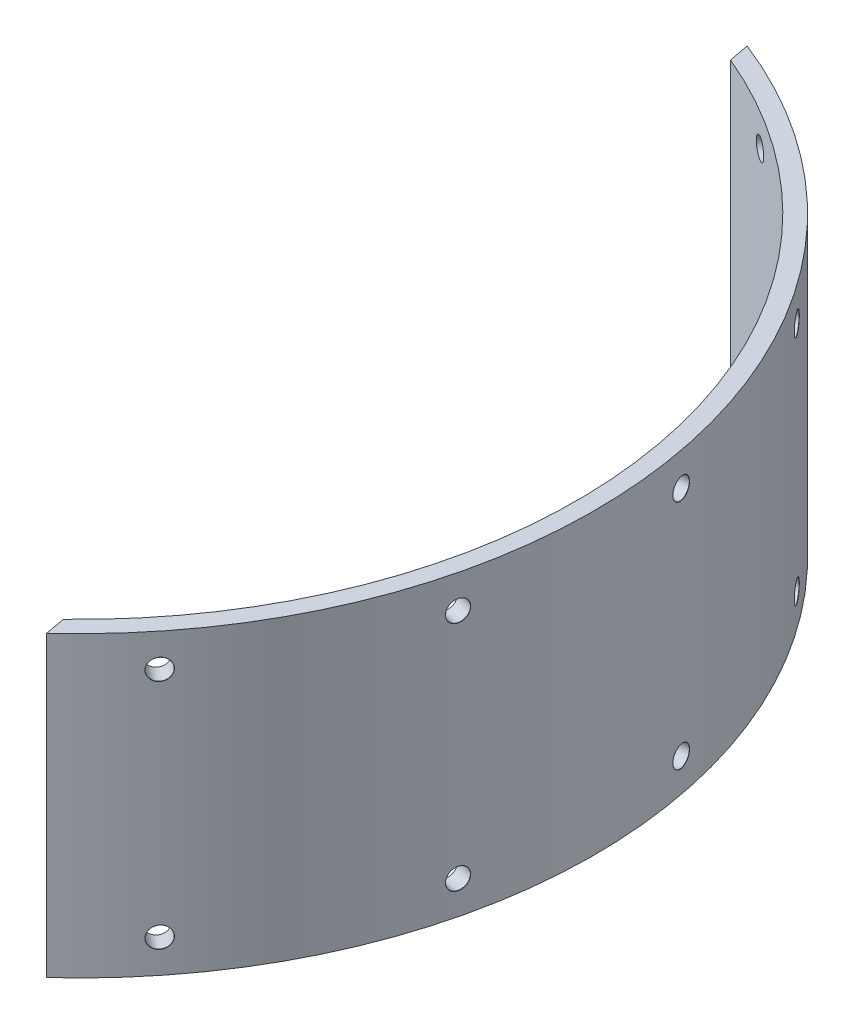
from build123d import *

# Parameters (mm, degrees)
BOSS_EXTRUDE1_DEPTH                             = 36
TAP_DRILL_FOR_M3X0_5_TAP2_D                     = 2.5
TAP_DRILL_FOR_M3X0_5_TAP2_DEPTH                 = 10
TAP_DRILL_FOR_M3X0_5_TAP2_CSINK_D               = 2.55
TAP_DRILL_FOR_M3X0_5_TAP2_CSINK_ANGLE           = 90
TAP_DRILL_FOR_M3X0_5_TAP2_TIP                   = 0.751075774
TAP_DRILL_FOR_M3X0_5_TAP2_ON_FACE_2_D           = 2.5
TAP_DRILL_FOR_M3X0_5_TAP2_ON_FACE_2_DEPTH       = 10
TAP_DRILL_FOR_M3X0_5_TAP2_ON_FACE_2_CSINK_D     = 2.55
TAP_DRILL_FOR_M3X0_5_TAP2_ON_FACE_2_CSINK_ANGLE = 90
TAP_DRILL_FOR_M3X0_5_TAP2_ON_FACE_2_TIP         = 0.751075774
TAP_DRILL_FOR_M3X0_5_TAP2_ON_FACE_3_D           = 2.5
TAP_DRILL_FOR_M3X0_5_TAP2_ON_FACE_3_DEPTH       = 10
TAP_DRILL_FOR_M3X0_5_TAP2_ON_FACE_3_CSINK_D     = 2.55
TAP_DRILL_FOR_M3X0_5_TAP2_ON_FACE_3_CSINK_ANGLE = 90
TAP_DRILL_FOR_M3X0_5_TAP2_ON_FACE_3_TIP         = 0.751075774
TAP_DRILL_FOR_M3X0_5_TAP2_ON_FACE_4_D           = 2.5
TAP_DRILL_FOR_M3X0_5_TAP2_ON_FACE_4_DEPTH       = 10
TAP_DRILL_FOR_M3X0_5_TAP2_ON_FACE_4_CSINK_D     = 2.55
TAP_DRILL_FOR_M3X0_5_TAP2_ON_FACE_4_CSINK_ANGLE = 90
TAP_DRILL_FOR_M3X0_5_TAP2_ON_FACE_4_TIP         = 0.751075774
TAP_DRILL_FOR_M3X0_5_TAP2_ON_FACE_5_D           = 2.5
TAP_DRILL_FOR_M3X0_5_TAP2_ON_FACE_5_DEPTH       = 10
TAP_DRILL_FOR_M3X0_5_TAP2_ON_FACE_5_CSINK_D     = 2.55
TAP_DRILL_FOR_M3X0_5_TAP2_ON_FACE_5_CSINK_ANGLE = 90
TAP_DRILL_FOR_M3X0_5_TAP2_ON_FACE_5_TIP         = 0.751075774
TAP_DRILL_FOR_M3X0_5_TAP2_ON_FACE_6_D           = 2.5
TAP_DRILL_FOR_M3X0_5_TAP2_ON_FACE_6_DEPTH       = 10
TAP_DRILL_FOR_M3X0_5_TAP2_ON_FACE_6_CSINK_D     = 2.55
TAP_DRILL_FOR_M3X0_5_TAP2_ON_FACE_6_CSINK_ANGLE = 90
TAP_DRILL_FOR_M3X0_5_TAP2_ON_FACE_6_TIP         = 0.751075774


with BuildPart() as part:
    # Sketch2 → Boss-Extrude1 (new body)
    with BuildSketch(Plane(origin=(0, 0, 0), x_dir=(1, 0, 0), z_dir=(0, 1, 0))):
        with BuildLine():
            Line((23.211171746, 55.328487294), (22.756816309, 57.793122625))
            ThreePointArc((22.756816309, 57.793122625), (61.082862318, 11.260623529), (41.868839503, -45.879385239))
            Line((41.868839503, -45.879385239), (41.414484066, -43.414749908))
            ThreePointArc((41.414484066, -43.414749908), (59.005724896, 10.877703318), (23.211171746, 55.328487294))
        make_face()
    extrude(amount=BOSS_EXTRUDE1_DEPTH)

    # Tap Drill for M3x0.5 Tap2
    with Locations(Plane(origin=(48.469996493, 4, 38.840406166), x_dir=(-0.625327146913, 0, 0.780362710112), z_dir=(0.780362710112, 0, 0.625327146913))):
        with Locations((0, 0)):
            CounterSinkHole(TAP_DRILL_FOR_M3X0_5_TAP2_D / 2, TAP_DRILL_FOR_M3X0_5_TAP2_CSINK_D / 2, depth=TAP_DRILL_FOR_M3X0_5_TAP2_DEPTH, counter_sink_angle=TAP_DRILL_FOR_M3X0_5_TAP2_CSINK_ANGLE)
            with Locations((0, 0, -(TAP_DRILL_FOR_M3X0_5_TAP2_DEPTH + TAP_DRILL_FOR_M3X0_5_TAP2_TIP / 2))):  # 118° drill point
                Cone(0, TAP_DRILL_FOR_M3X0_5_TAP2_D / 2, TAP_DRILL_FOR_M3X0_5_TAP2_TIP, mode=Mode.SUBTRACT)

    # Tap Drill for M3x0.5 Tap2 on face 2
    with Locations(Plane(origin=(60.348964799, 4, 14.694221955), x_dir=(-0.236575996978, 0, 0.97161298759), z_dir=(0.97161298759, 0, 0.236575996978))):
        with Locations((0, 0), (0, -28)):
            CounterSinkHole(TAP_DRILL_FOR_M3X0_5_TAP2_ON_FACE_2_D / 2, TAP_DRILL_FOR_M3X0_5_TAP2_ON_FACE_2_CSINK_D / 2, depth=TAP_DRILL_FOR_M3X0_5_TAP2_ON_FACE_2_DEPTH, counter_sink_angle=TAP_DRILL_FOR_M3X0_5_TAP2_ON_FACE_2_CSINK_ANGLE)
            with Locations((0, 0, -(TAP_DRILL_FOR_M3X0_5_TAP2_ON_FACE_2_DEPTH + TAP_DRILL_FOR_M3X0_5_TAP2_ON_FACE_2_TIP / 2))):  # 118° drill point
                Cone(0, TAP_DRILL_FOR_M3X0_5_TAP2_ON_FACE_2_D / 2, TAP_DRILL_FOR_M3X0_5_TAP2_ON_FACE_2_TIP, mode=Mode.SUBTRACT)

    # Tap Drill for M3x0.5 Tap2 on face 3
    with Locations(Plane(origin=(61.023668412, 4, -11.577115564), x_dir=(0.186390935187, 0, 0.982475658365), z_dir=(0.982475658365, 0, -0.186390935187))):
        with Locations((0, 0), (0, -28)):
            CounterSinkHole(TAP_DRILL_FOR_M3X0_5_TAP2_ON_FACE_3_D / 2, TAP_DRILL_FOR_M3X0_5_TAP2_ON_FACE_3_CSINK_D / 2, depth=TAP_DRILL_FOR_M3X0_5_TAP2_ON_FACE_3_DEPTH, counter_sink_angle=TAP_DRILL_FOR_M3X0_5_TAP2_ON_FACE_3_CSINK_ANGLE)
            with Locations((0, 0, -(TAP_DRILL_FOR_M3X0_5_TAP2_ON_FACE_3_DEPTH + TAP_DRILL_FOR_M3X0_5_TAP2_ON_FACE_3_TIP / 2))):  # 118° drill point
                Cone(0, TAP_DRILL_FOR_M3X0_5_TAP2_ON_FACE_3_D / 2, TAP_DRILL_FOR_M3X0_5_TAP2_ON_FACE_3_TIP, mode=Mode.SUBTRACT)

    # Tap Drill for M3x0.5 Tap2 on face 4
    with Locations(Plane(origin=(50.76222074, 4, -35.792662052), x_dir=(0.576259062129, 0, 0.817267088114), z_dir=(0.817267088114, 0, -0.576259062129))):
        with Locations((1e-09, 0), (1e-09, -28)):
            CounterSinkHole(TAP_DRILL_FOR_M3X0_5_TAP2_ON_FACE_4_D / 2, TAP_DRILL_FOR_M3X0_5_TAP2_ON_FACE_4_CSINK_D / 2, depth=TAP_DRILL_FOR_M3X0_5_TAP2_ON_FACE_4_DEPTH, counter_sink_angle=TAP_DRILL_FOR_M3X0_5_TAP2_ON_FACE_4_CSINK_ANGLE)
            with Locations((0, 0, -(TAP_DRILL_FOR_M3X0_5_TAP2_ON_FACE_4_DEPTH + TAP_DRILL_FOR_M3X0_5_TAP2_ON_FACE_4_TIP / 2))):  # 118° drill point
                Cone(0, TAP_DRILL_FOR_M3X0_5_TAP2_ON_FACE_4_D / 2, TAP_DRILL_FOR_M3X0_5_TAP2_ON_FACE_4_TIP, mode=Mode.SUBTRACT)

    # Tap Drill for M3x0.5 Tap2 on face 5
    with Locations(Plane(origin=(31.43401099, 4, -53.570707148), x_dir=(-0.862483707842, 0, -0.506084828569), z_dir=(0.506084828569, 0, -0.862483707842))):
        with Locations((0, 0), (0, 28.12048306)):
            CounterSinkHole(TAP_DRILL_FOR_M3X0_5_TAP2_ON_FACE_5_D / 2, TAP_DRILL_FOR_M3X0_5_TAP2_ON_FACE_5_CSINK_D / 2, depth=TAP_DRILL_FOR_M3X0_5_TAP2_ON_FACE_5_DEPTH, counter_sink_angle=TAP_DRILL_FOR_M3X0_5_TAP2_ON_FACE_5_CSINK_ANGLE)
            with Locations((0, 0, -(TAP_DRILL_FOR_M3X0_5_TAP2_ON_FACE_5_DEPTH + TAP_DRILL_FOR_M3X0_5_TAP2_ON_FACE_5_TIP / 2))):  # 118° drill point
                Cone(0, TAP_DRILL_FOR_M3X0_5_TAP2_ON_FACE_5_D / 2, TAP_DRILL_FOR_M3X0_5_TAP2_ON_FACE_5_TIP, mode=Mode.SUBTRACT)

    # Tap Drill for M3x0.5 Tap2 on face 6
    with Locations(Plane(origin=(48.469996493, 32, 38.840406166), x_dir=(-0.625326915988, 0, 0.780362895159), z_dir=(0.780362895159, 0, 0.625326915988))):
        with Locations((0, 0)):
            CounterSinkHole(TAP_DRILL_FOR_M3X0_5_TAP2_ON_FACE_6_D / 2, TAP_DRILL_FOR_M3X0_5_TAP2_ON_FACE_6_CSINK_D / 2, depth=TAP_DRILL_FOR_M3X0_5_TAP2_ON_FACE_6_DEPTH, counter_sink_angle=TAP_DRILL_FOR_M3X0_5_TAP2_ON_FACE_6_CSINK_ANGLE)
            with Locations((0, 0, -(TAP_DRILL_FOR_M3X0_5_TAP2_ON_FACE_6_DEPTH + TAP_DRILL_FOR_M3X0_5_TAP2_ON_FACE_6_TIP / 2))):  # 118° drill point
                Cone(0, TAP_DRILL_FOR_M3X0_5_TAP2_ON_FACE_6_D / 2, TAP_DRILL_FOR_M3X0_5_TAP2_ON_FACE_6_TIP, mode=Mode.SUBTRACT)


solid = part.part
